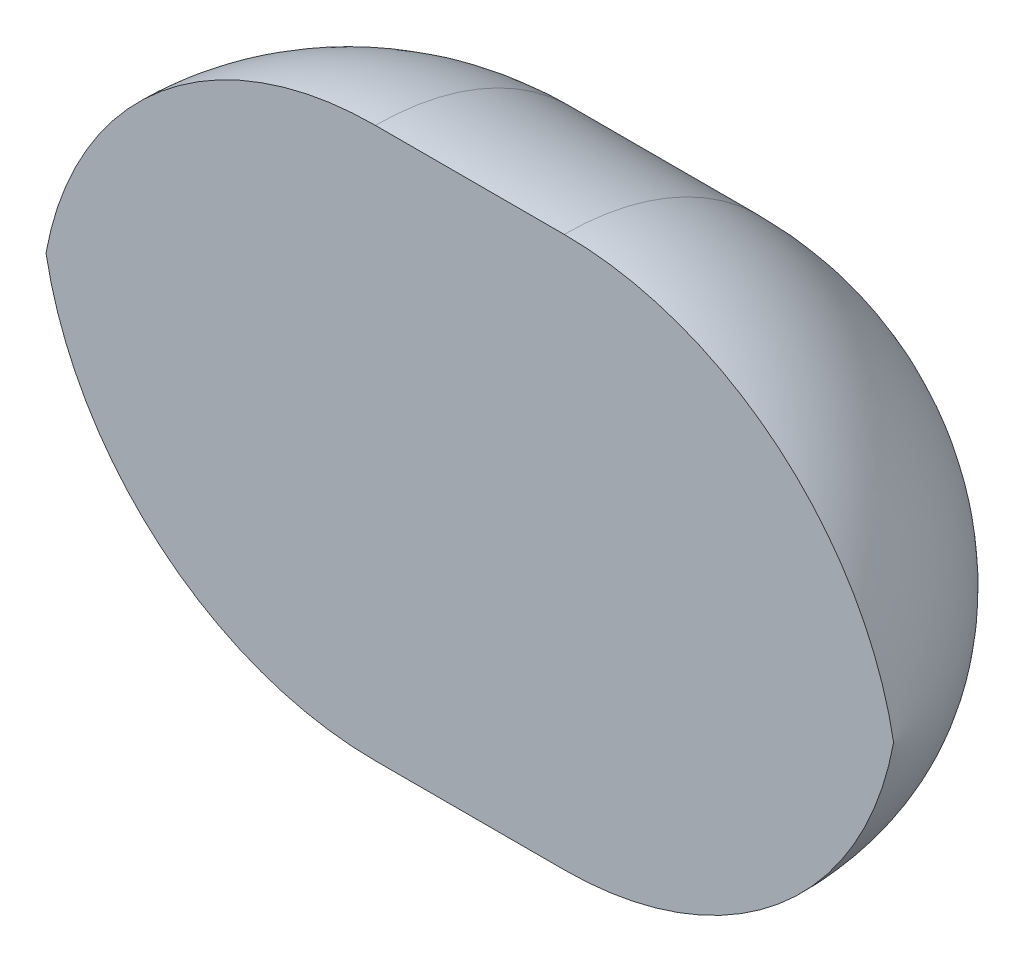
from build123d import *

# Parameters (mm, degrees)
REVOLVE1_ANGLE = 180


with BuildPart() as part:
    # Sketch1 → Revolve1 (revolve)
    with BuildSketch(Plane.XY):
        with BuildLine():
            Line((-31.989852176, 9.792890068), (-44.650157049, 9.792890068))
            ThreePointArc((-44.650157049, 9.792890068), (-42.935468697, 12.740206838), (-39.730004612, 13.902890068))
            Line((-39.730004612, 13.902890068), (-36.910004612, 13.902890068))
            ThreePointArc((-36.910004612, 13.902890068), (-33.704540527, 12.740206838), (-31.989852176, 9.792890068))
        make_face()
    revolve(axis=Axis((-31.989852176, 9.792890068, 0), (-1, 0, 0)), revolution_arc=REVOLVE1_ANGLE)


solid = part.part
